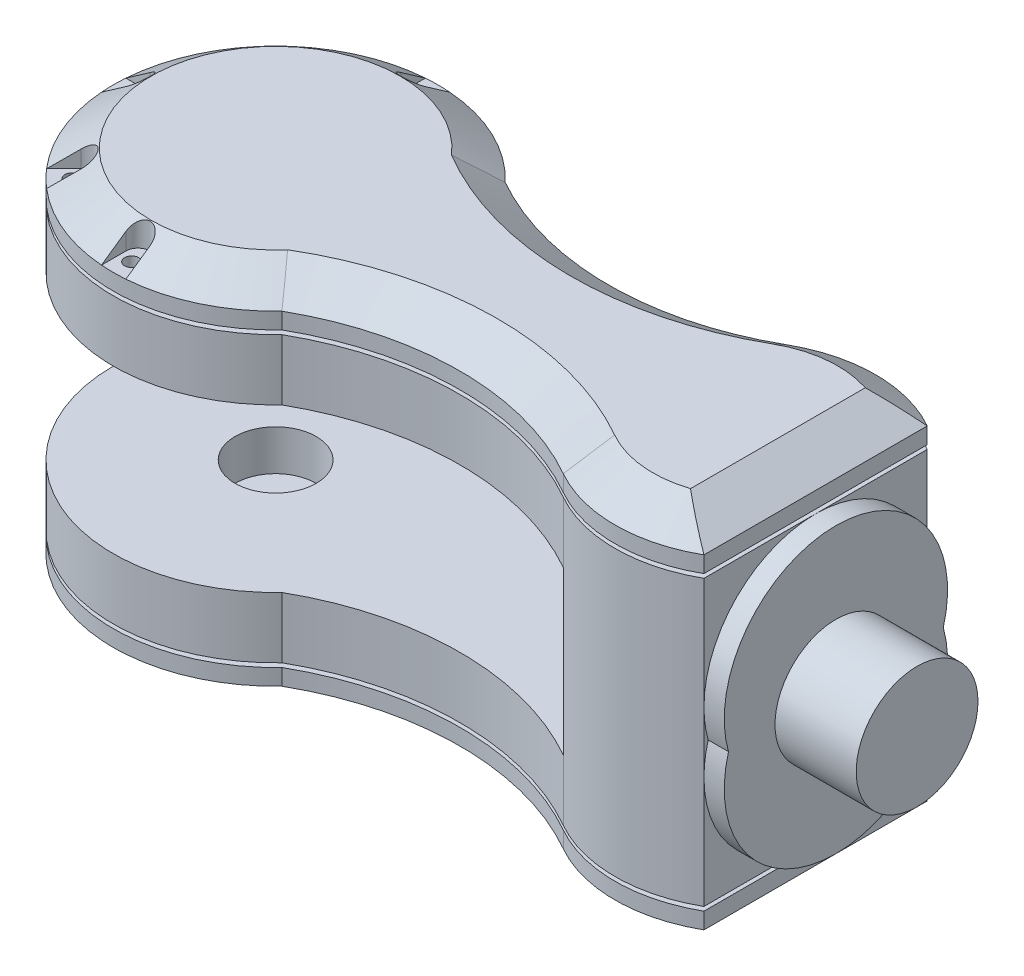
from build123d import *

# Parameters (mm, degrees)
SKETCH1_R                       = 27.5
BOSS_EXTRUDE1_DEPTH             = 5
BOSS_EXTRUDE2_DEPTH             = 15
BOSS_EXTRUDE10_DEPTH            = 1
BOSS_EXTRUDE14_DEPTH            = 4
BOSS_EXTRUDE15_DEPTH            = 6.5
BOSS_EXTRUDE15_DRAFT            = 55
CUT_EXTRUDE1_DEPTH              = 6.5
SKETCH21_R                      = 1.75
CUT_EXTRUDE2_DEPTH              = 5
CIRPATTERN1_COUNT               = 3
CIRPATTERN1_ANGLE               = 90
CIRPATTERN1_THE_OTHER_WAY_COUNT = 3
CIRPATTERN1_THE_OTHER_WAY_ANGLE = 90
BOSS_EXTRUDE16_DEPTH            = 40
SKETCH25_R                      = 15
BOSS_EXTRUDE17_DEPTH            = 20
SKETCH26_R                      = 10
CUT_EXTRUDE3_DEPTH              = 10


with BuildPart() as part:
    # Sketch1 → Boss-Extrude1 (new body)
    with BuildSketch(Plane.YZ):
        with Locations(Location((0, 0, 0), (0, 0, 270))):
            Circle(SKETCH1_R)
    extrude(amount=-BOSS_EXTRUDE1_DEPTH)



with BuildPart() as body_2:
    # Sketch3 → Boss-Extrude2 (new body)
    with BuildSketch(Plane(origin=(0, 27.5, 0), x_dir=(-1, 0, 0), z_dir=(0, 1, 0))):
        with BuildLine():
            Line((5, 27.5), (5, -27.5))
            ThreePointArc((5, -27.5), (22.325437484, -32.08899515), (39.650874968, -27.5))
            ThreePointArc((39.650874968, -27.5), (74.301749936, -18.3220097), (108.952624903, -27.5))
            ThreePointArc((108.952624903, -27.5), (178, 0), (108.952624903, 27.5))
            ThreePointArc((108.952624903, 27.5), (74.301749936, 18.3220097), (39.650874968, 27.5))
            ThreePointArc((39.650874968, 27.5), (22.325437484, 32.08899515), (5, 27.5))
        make_face()
    extrude(amount=BOSS_EXTRUDE2_DEPTH)

    # Sketch7 → Boss-Extrude10 (add)
    with BuildSketch(Plane(origin=(0, 42.5, 0), x_dir=(-1, 0, 0), z_dir=(0, 1, 0))):
        with BuildLine():
            Line((7.5, 26.010551184), (7.5, -26.010551184))
            ThreePointArc((7.5, -26.010551184), (23.04307188, -29.58107112), (38.413343719, -25.327785368))
            ThreePointArc((38.413343719, -25.327785368), (74.492067352, -15.822259499), (110.520388622, -25.517071903))
            ThreePointArc((110.520388622, -25.517071903), (175.5, 0), (110.520388622, 25.517071903))
            ThreePointArc((110.520388622, 25.517071903), (74.492067352, 15.822259499), (38.413343719, 25.327785368))
            ThreePointArc((38.413343719, 25.327785368), (23.04307188, 29.58107112), (7.5, 26.010551184))
        make_face()
    extrude(amount=BOSS_EXTRUDE10_DEPTH)

    # Sketch18 → Boss-Extrude14 (add)
    with BuildSketch(Plane(origin=(0, 43.5, 0), x_dir=(-1, 0, 0), z_dir=(0, 1, 0))):
        with BuildLine():
            Line((5, 27.5), (5, -27.5))
            ThreePointArc((5, -27.5), (22.325437484, -32.08899515), (39.650874968, -27.5))
            ThreePointArc((39.650874968, -27.5), (74.301749936, -18.3220097), (108.952624903, -27.5))
            ThreePointArc((108.952624903, -27.5), (178, 0), (108.952624903, 27.5))
            ThreePointArc((108.952624903, 27.5), (74.301749936, 18.3220097), (39.650874968, 27.5))
            ThreePointArc((39.650874968, 27.5), (22.325437484, 32.08899515), (5, 27.5))
        make_face()
    extrude(amount=BOSS_EXTRUDE14_DEPTH)


with BuildPart() as boss_extrude15_tool:
    # Sketch19 → Boss-Extrude15 (with draft: the straight prism first)
    with BuildSketch(Plane(origin=(0, 47.5, 0), x_dir=(-1, 0, 0), z_dir=(0, 1, 0))):
        with BuildLine():
            Line((5, 27.5), (5, -27.5))
            ThreePointArc((5, -27.5), (22.325437484, -32.08899515), (39.650874968, -27.5))
            ThreePointArc((39.650874968, -27.5), (74.301749936, -18.3220097), (108.952624903, -27.5))
            ThreePointArc((108.952624903, -27.5), (178, 0), (108.952624903, 27.5))
            ThreePointArc((108.952624903, 27.5), (74.301749936, 18.3220097), (39.650874968, 27.5))
            ThreePointArc((39.650874968, 27.5), (22.325437484, 32.08899515), (5, 27.5))
        make_face()
    extrude(amount=BOSS_EXTRUDE15_DEPTH)
    # Boss-Extrude15: the draft: its side faces are tilted about the plane it starts from
    boss_extrude15_sides = [boss_extrude15_tool.faces().sort_by_distance(p)[0] for p in [
        (-22.325437484, 50.75, 32.08899515),
        (-5, 50.75, 0),
        (-22.325437484, 50.75, -32.08899515),
        (-74.301749936, 50.75, -18.3220097),
        (-178, 50.75, 0),
        (-74.301749936, 50.75, 18.3220097),
    ]]
    draft(boss_extrude15_sides, Plane(origin=(0, 47.5, 0), x_dir=(-1, 0, 0), z_dir=(0, 1, 0)), BOSS_EXTRUDE15_DRAFT)


with BuildPart() as body_2_1:
    add(body_2.part)

    # Boss-Extrude15: add boss_extrude15_tool
    add(boss_extrude15_tool.part)

    # Sketch20 → Cut-Extrude1 (cut)
    with BuildSketch(Plane(origin=(0, 54, 0), x_dir=(-1, 0, 0), z_dir=(0, 1, 0))):
        with BuildLine():
            Line((177.88734135, 3), (171.88734135, 3))
            ThreePointArc((171.88734135, 3), (168.88734135, 0), (171.88734135, -3))
            Line((171.88734135, -3), (177.88734135, -3))
            ThreePointArc((177.88734135, -3), (178.88734135, 0), (177.88734135, 3))
        make_face()
    cut_extrude1 = extrude(amount=-CUT_EXTRUDE1_DEPTH, mode=Mode.SUBTRACT)

    # Sketch21 → Cut-Extrude2 (cut)
    with BuildSketch(Plane(origin=(0, 47.5, 0), x_dir=(-1, 0, 0), z_dir=(0, 1, 0))):
        with Locations(Location((173.443670675, 0, 0), (0, 0, 90))):
            Circle(SKETCH21_R)
    cut_extrude2 = extrude(amount=-CUT_EXTRUDE2_DEPTH, mode=Mode.SUBTRACT)

    # CirPattern1: Cut-Extrude1, Cut-Extrude2 ×3 about axis
    cirpattern1_axis = Axis((-138, 0, 0), (0, 1, 0))
    add([cut_extrude1.rotate(cirpattern1_axis, i * CIRPATTERN1_ANGLE / (CIRPATTERN1_COUNT - 1)) for i in range(1, CIRPATTERN1_COUNT)], mode=Mode.SUBTRACT)
    add([cut_extrude2.rotate(cirpattern1_axis, i * CIRPATTERN1_ANGLE / (CIRPATTERN1_COUNT - 1)) for i in range(1, CIRPATTERN1_COUNT)], mode=Mode.SUBTRACT)

    # CirPattern1 the other way: Cut-Extrude1, Cut-Extrude2 ×3 about axis
    cirpattern1_the_other_way_axis = Axis((-138, 0, 0), (0, -1, 0))
    add([cut_extrude1.rotate(cirpattern1_the_other_way_axis, i * CIRPATTERN1_THE_OTHER_WAY_ANGLE / (CIRPATTERN1_THE_OTHER_WAY_COUNT - 1)) for i in range(1, CIRPATTERN1_THE_OTHER_WAY_COUNT)], mode=Mode.SUBTRACT)
    add([cut_extrude2.rotate(cirpattern1_the_other_way_axis, i * CIRPATTERN1_THE_OTHER_WAY_ANGLE / (CIRPATTERN1_THE_OTHER_WAY_COUNT - 1)) for i in range(1, CIRPATTERN1_THE_OTHER_WAY_COUNT)], mode=Mode.SUBTRACT)


with BuildPart() as part_1:
    add(part.part)

    add(body_2_1.part)  # Boss-Extrude16 merges body 2
    # Sketch23 → Boss-Extrude16 (add)
    with BuildSketch(Plane.XZ.offset(-27.5)):
        with BuildLine():
            Line((-39.650874968, 27.5), (-39.650874968, -27.5))
            ThreePointArc((-39.650874968, -27.5), (-22.325437484, -32.08899515), (-5, -27.5))
            Line((-5, -27.5), (-5, 27.5))
            ThreePointArc((-5, 27.5), (-22.325437484, 32.08899515), (-39.650874968, 27.5))
        make_face()
    extrude(amount=BOSS_EXTRUDE16_DEPTH)

    # Mirror1: part across plane


with BuildPart() as part_2:
    add(part_1.part)
    add(part_1.part.mirror(Plane(origin=(0, 7.5, 0), x_dir=(0, 0, 1), z_dir=(0, -1, 0))))

    # Sketch25 → Boss-Extrude17 (add)
    with BuildSketch(Plane.YZ):
        with Locations(Location((7.5, 0, 0), (0, 0, 270))):
            Circle(SKETCH25_R)
    extrude(amount=BOSS_EXTRUDE17_DEPTH)

    # Sketch26 → Cut-Extrude3 (cut)
    with BuildSketch(Plane.XZ.offset(-27.5)):
        with Locations(Location((-138, 0, 0), (0, 0, 270))):
            Circle(SKETCH26_R)
    cut_extrude3 = extrude(amount=-CUT_EXTRUDE3_DEPTH, mode=Mode.SUBTRACT)

    # Mirror2: Cut-Extrude3 across plane
    add(cut_extrude3.mirror(Plane(origin=(0, 7.5, 0), x_dir=(0, 0, 1), z_dir=(0, -1, 0))), mode=Mode.SUBTRACT)


solid = part_2.part
